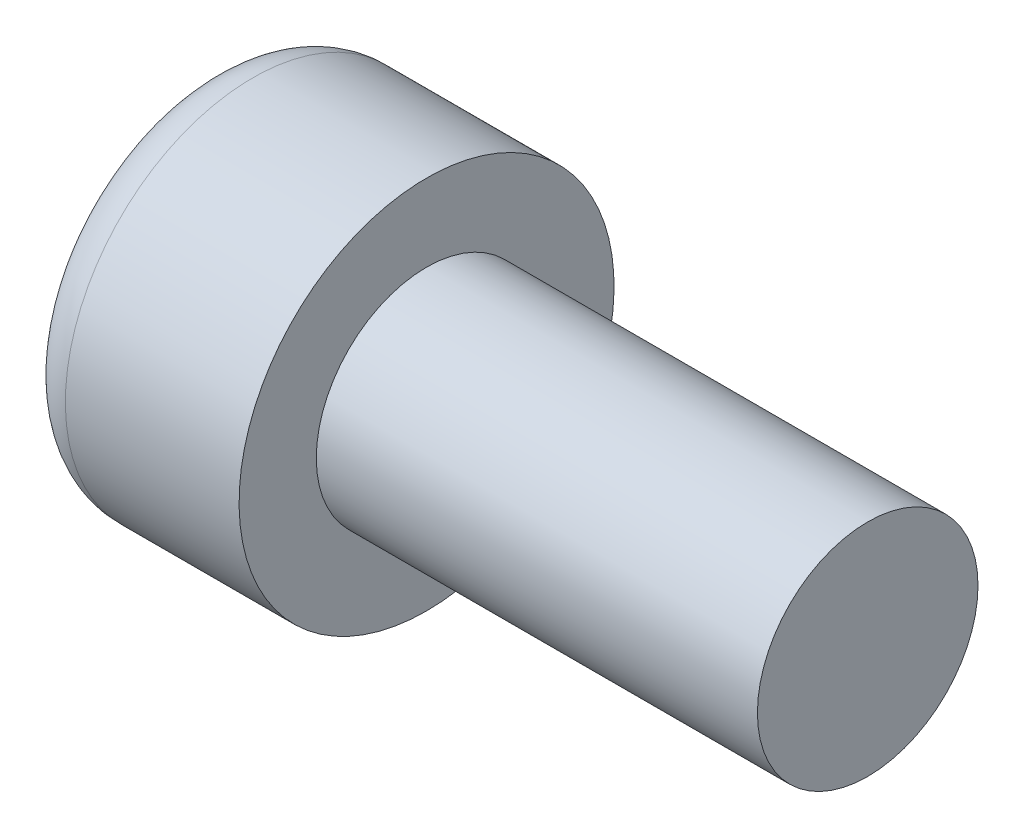
from build123d import *

# Parameters (mm, degrees)
CUT_EXTRUDE1_DEPTH = 2.5


with BuildPart() as part:
    # Sketch1 → Revolve1 (revolve)
    with BuildSketch(Plane.XY, mode=Mode.PRIVATE) as revolve1_sk:
        with BuildLine():
            Line((0, 0), (0, 3.1875))
            ThreePointArc((0, 3.1875), (0.311199045, 3.938800955), (1.0625, 4.25))
            Line((1.0625, 4.25), (5, 4.25))
            Line((5, 4.25), (5, 2.5))
            Line((5, 2.5), (15, 2.5))
            Line((15, 2.5), (15, 0))
            Line((15, 0), (0, 0))
        make_face()
    revolve(revolve1_sk.sketch.rotate(Axis((0, 0, 0), (1, 0, 0)), 180), axis=Axis((0, 0, 0), (1, 0, 0)))

    # Sketch2 → Cut-Extrude1 (cut)
    with BuildSketch(Plane.ZY):
        Polygon((0, 2.309401077), (-2, 1.154700538), (-2, -1.154700538), (0, -2.309401077), (2, -1.154700538), (2, 1.154700538), align=None)
    extrude(amount=-CUT_EXTRUDE1_DEPTH, mode=Mode.SUBTRACT)


solid = part.part
